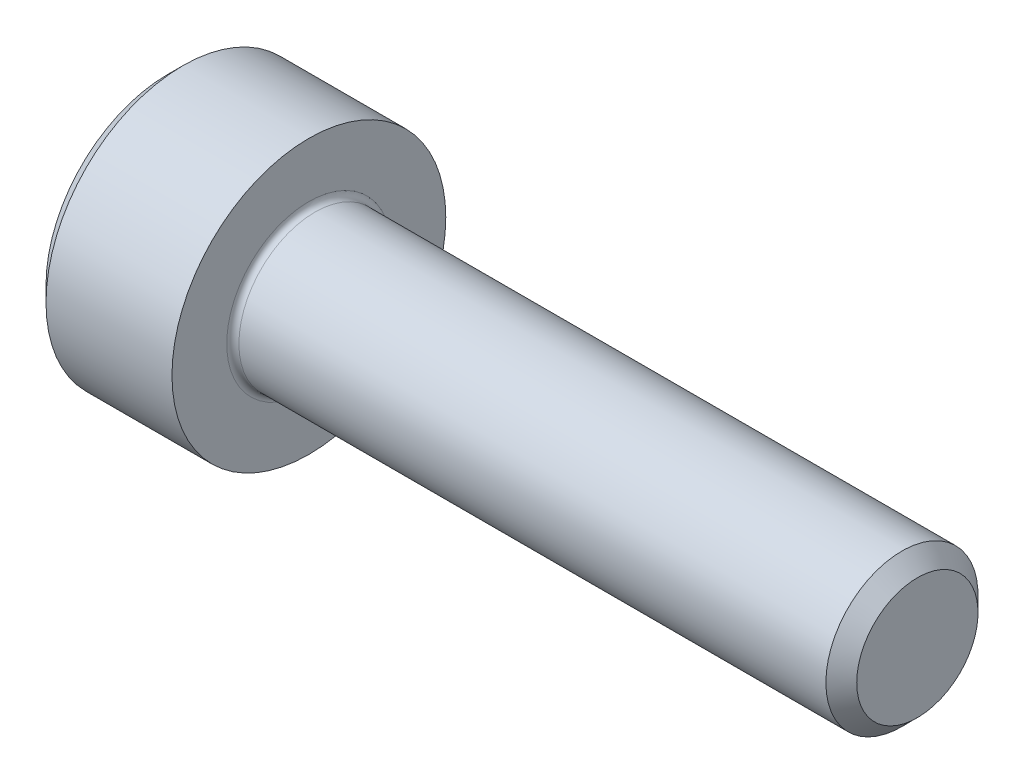
from build123d import *

# Parameters (mm, degrees)
FILLET1_R   = 0.1
HEX_2_DEPTH = 1.1


with BuildPart() as part:
    # BodySke → Base-Revolve (revolve)
    with BuildSketch(Plane.XY, mode=Mode.PRIVATE) as base_revolve_sk:
        Polygon((0, 0), (0, 2), (0.25, 2.25), (2.32, 2.25), (2.32, 1.25), (12.0665, 1.25), (12.32, 0.9965), (12.32, 0), align=None)
    revolve(base_revolve_sk.sketch.rotate(Axis((-31.75, 0, 0), (1, 0, 0)), 90), axis=Axis((-31.75, 0, 0), (1, 0, 0)))

    # Fillet1
    fillet1_edges = [part.edges().sort_by_distance(p)[0] for p in [
        (2.32, 0, -1.25),
    ]]
    fillet(fillet1_edges, radius=FILLET1_R)

    # Sketch2 → Hex-PreBroach (revolve, cut)
    with BuildSketch(Plane.XY, mode=Mode.PRIVATE) as hex_prebroach_sk:
        Polygon((0, 1.0225), (1.1, 1.0225), (1.69034065, 0), (0, 0), align=None)
    revolve(hex_prebroach_sk.sketch.rotate(Axis((0, 0, 0), (1, 0, 0)), 90), axis=Axis((0, 0, 0), (1, 0, 0)), mode=Mode.SUBTRACT)

    # Sketch3 → Hex 2 (cut)
    with BuildSketch(Plane(origin=(0, 0, 0), x_dir=(0, 0.500000000000001, 0.866025403784438), z_dir=(-1, 0, 0))):
        Polygon((0.59034065, 1.0225), (-0.59034065, 1.0225), (-1.1806813, 0), (-0.59034065, -1.0225), (0.59034065, -1.0225), (1.1806813, 0), align=None)
    extrude(amount=-HEX_2_DEPTH, mode=Mode.SUBTRACT)


solid = part.part
